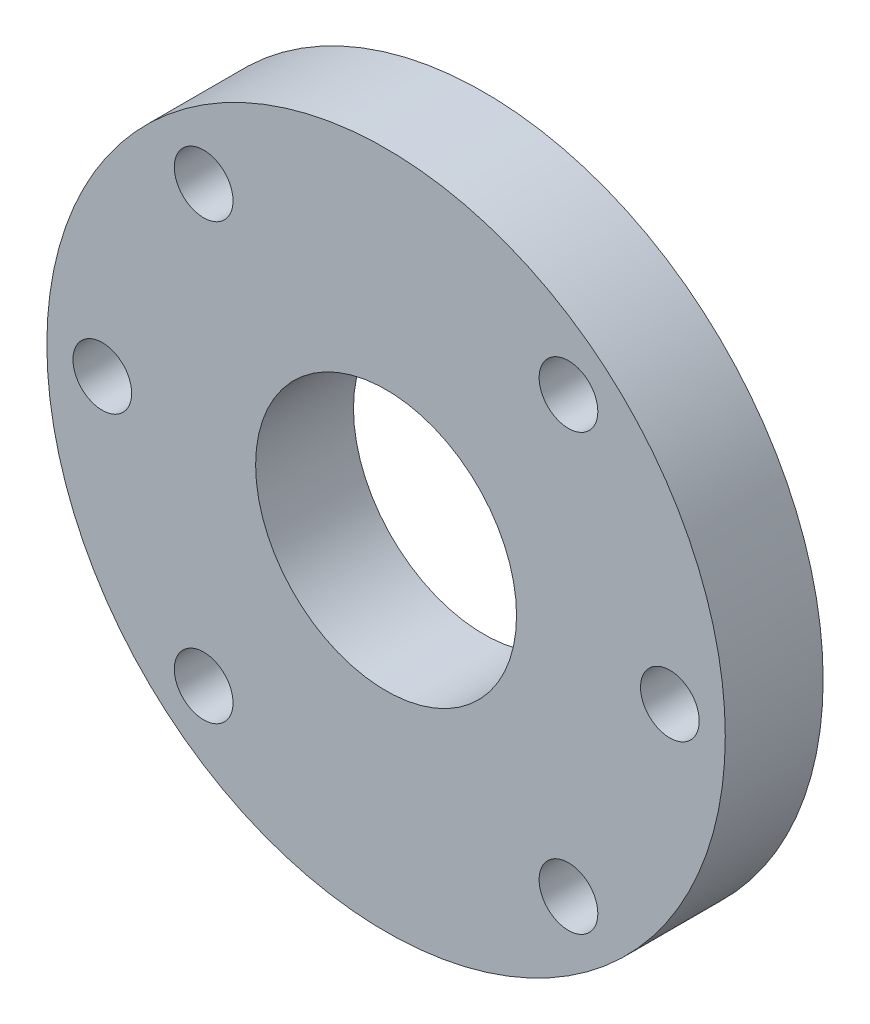
from build123d import *

# Parameters (mm, degrees)
SKETCH_1_R          = 26
SKETCH_1_R_2        = 2.25
EXTRUDE_1_DEPTH     = 7.5
SKETCH_2_R          = 10
CUT_EXTRUDE_1_DEPTH = 38.526657192


with BuildPart() as part:
    # 草图1 → 凸台-拉伸1 (new body)
    with BuildSketch(Plane.XY):
        Circle(SKETCH_1_R)
        with Locations((-21.75, 0)):
            Circle(SKETCH_1_R_2, mode=Mode.SUBTRACT)
        with Locations((-13.980630511, 16.661466638)):
            Circle(SKETCH_1_R_2, mode=Mode.SUBTRACT)
        with Locations((-13.980630511, -16.661466638)):
            Circle(SKETCH_1_R_2, mode=Mode.SUBTRACT)
        with Locations((13.980630511, -16.661466638)):
            Circle(SKETCH_1_R_2, mode=Mode.SUBTRACT)
        with Locations((21.75, 0)):
            Circle(SKETCH_1_R_2, mode=Mode.SUBTRACT)
        with Locations((13.980630511, 16.661466638)):
            Circle(SKETCH_1_R_2, mode=Mode.SUBTRACT)
    extrude(amount=EXTRUDE_1_DEPTH)

    # 草图2 → 切除-拉伸1 (cut, through all)
    with BuildSketch(Plane.XY.offset(7.5)):
        Circle(SKETCH_2_R)
    extrude(amount=-CUT_EXTRUDE_1_DEPTH, mode=Mode.SUBTRACT)


solid = part.part
